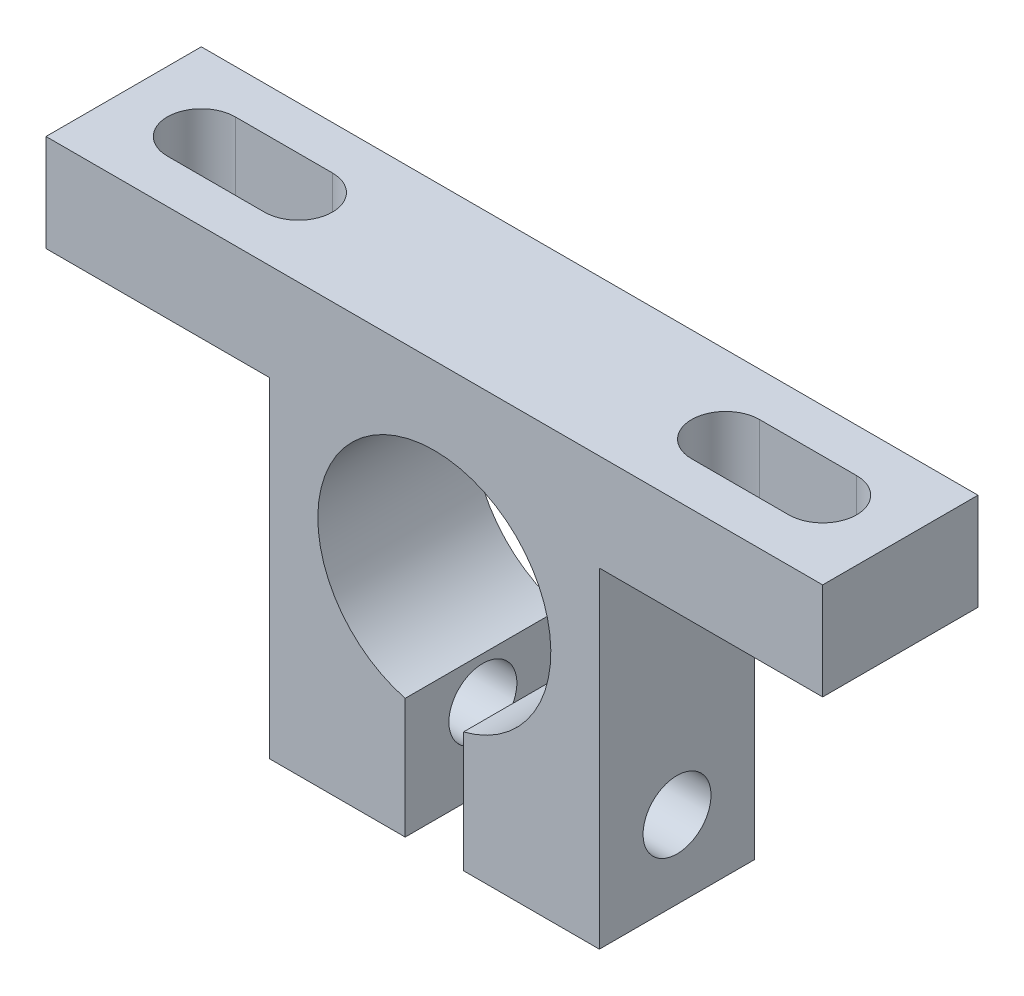
from build123d import *

# Parameters (mm, degrees)
EXTRUDE_1_DEPTH     = 8
CUT_EXTRUDE_1_DEPTH = 8
SKETCH_3_R          = 1.75
CUT_EXTRUDE_2_DEPTH = 26


with BuildPart() as part:
    # 草图1 → 凸台-拉伸1 (new body)
    with BuildSketch(Plane.XY):
        with BuildLine():
            Line((20, 10), (-20, 10))
            Line((-20, 10), (-20, 5))
            Line((-20, 5), (-8.5, 5))
            Line((-8.5, 5), (-8.5, -12))
            Line((-8.5, -12), (-1.5, -12))
            Line((-1.5, -12), (-1.5, -5.809475019))
            ThreePointArc((-1.5, -5.809475019), (0, 6), (1.5, -5.809475019))
            Line((1.5, -5.809475019), (1.5, -12))
            Line((1.5, -12), (8.5, -12))
            Line((8.5, -12), (8.5, 5))
            Line((8.5, 5), (20, 5))
            Line((20, 5), (20, 10))
        make_face()
    extrude(amount=EXTRUDE_1_DEPTH)

    # 草图2 → 切除-拉伸1 (cut)
    with BuildSketch(Plane(origin=(0, 10, 0), x_dir=(1, 0, 0), z_dir=(0, 1, 0))):
        with BuildLine():
            Line((-16, -2.25), (-11, -2.25))
            ThreePointArc((-11, -2.25), (-9.25, -4), (-11, -5.75))
            Line((-11, -5.75), (-16, -5.75))
            ThreePointArc((-16, -5.75), (-17.75, -4), (-16, -2.25))
        make_face()
        with BuildLine():
            Line((16, -5.75), (11, -5.75))
            ThreePointArc((11, -5.75), (9.25, -4), (11, -2.25))
            Line((11, -2.25), (16, -2.25))
            ThreePointArc((16, -2.25), (17.75, -4), (16, -5.75))
        make_face()
    extrude(amount=-CUT_EXTRUDE_1_DEPTH, mode=Mode.SUBTRACT)

    # 草图3 → 切除-拉伸2 (cut)
    with BuildSketch(Plane.ZY.offset(8.5)):
        with Locations((4, -8)):
            Circle(SKETCH_3_R)
    extrude(amount=-CUT_EXTRUDE_2_DEPTH, mode=Mode.SUBTRACT)


solid = part.part
